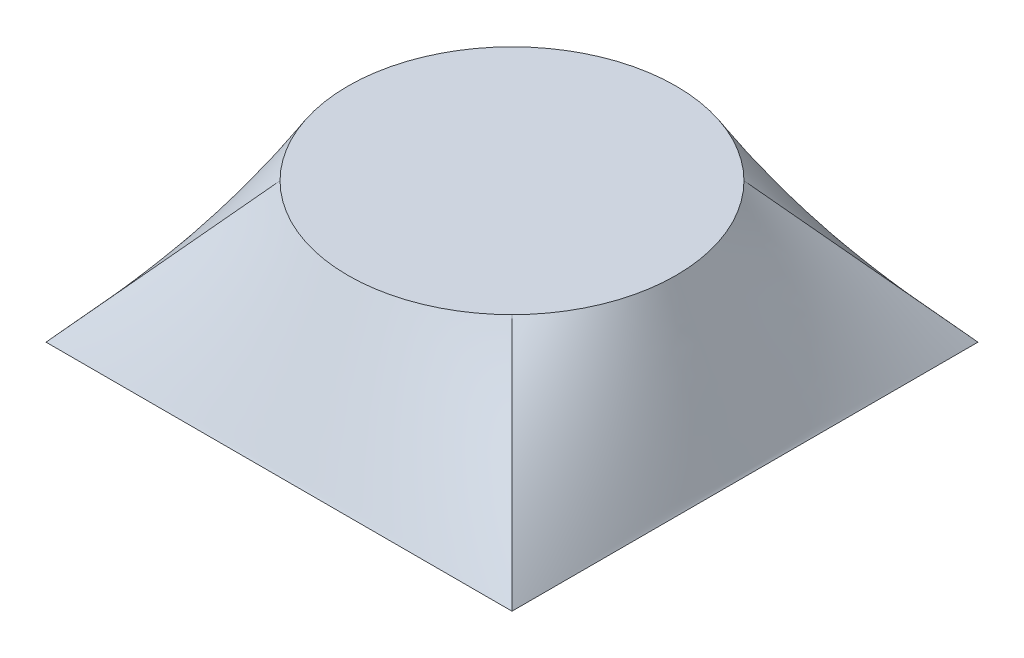
from build123d import *


with BuildPart() as part:
    # Эскиз1 → По сечениям1 section 0
    with BuildSketch(Plane(origin=(0, 0, 0), x_dir=(1, 0, 0), z_dir=(0, 1, 0))):
        with BuildLine():
            Line((20, 20), (-20, 20))
            Line((-20, 20), (-20, -20))
            Line((-20, -20), (20, -20))
            Line((20, -20), (20, 20))
        make_face()
    # Эскиз2 for По сечениям1 → По сечениям1 section 1
    with BuildSketch(Plane(origin=(0, 12, 0), x_dir=(1, 0, 0), z_dir=(0, 1, 0))):
        with BuildLine():
            # circular arc as an exact rational Bezier (weights 1, cos(half-angle), 1)
            Bezier((9.956044035, 9.956044035), (0, 19.91208807), (-9.956044035, 9.956044035), weights=[1, 0.707106781, 1])
            Bezier((-9.956044035, 9.956044035), (-19.91208807, 0), (-9.956044035, -9.956044035), weights=[1, 0.707106781, 1])
            Bezier((-9.956044035, -9.956044035), (0, -19.91208807), (9.956044035, -9.956044035), weights=[1, 0.707106781, 1])
            Bezier((9.956044035, -9.956044035), (19.91208807, 0), (9.956044035, 9.956044035), weights=[1, 0.707106781, 1])
        make_face()
    loft()


solid = part.part
